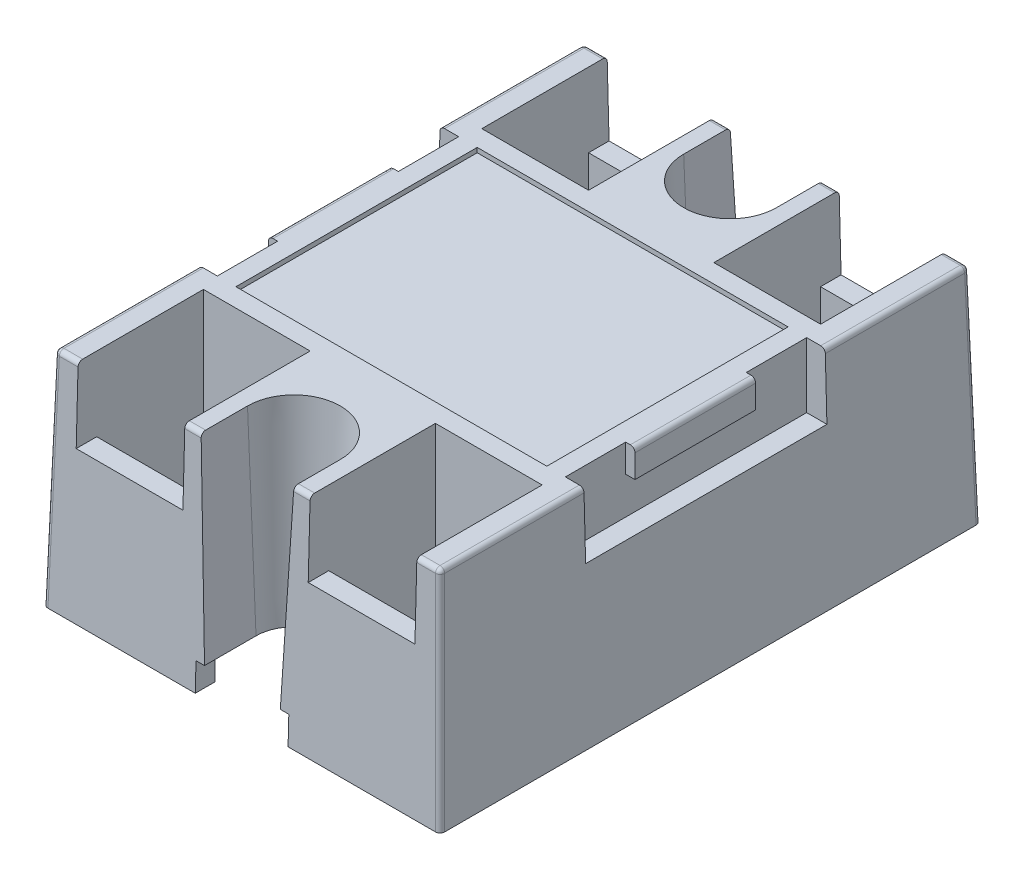
from build123d import *

# Parameters (mm, degrees)
SKETCH1_W            = 41.5
SKETCH1_H            = 57
BOSS_EXTRUDE1_DEPTH  = 24
CUT_EXTRUDE1_DEPTH   = 21
CUT_EXTRUDE1_DRAFT   = -2.5
SKETCH3_W            = 11.5
SKETCH3_H            = 13.5
CUT_EXTRUDE2_DEPTH   = 8
SKETCH4_W            = 11.5
SKETCH4_H            = 11.5
CUT_EXTRUDE3_DEPTH   = 39.714499868
MIRROR1_COPY_1_DEPTH = 21
MIRROR1_COPY_1_DRAFT = -2.5
SKETCH5_W            = 26
SKETCH5_H            = 7
CUT_EXTRUDE4_DEPTH   = 2
SKETCH6_W            = 13
SKETCH6_H            = 3
BOSS_EXTRUDE2_DEPTH  = 1
SKETCH7_W            = 33.5
SKETCH7_H            = 26
CUT_EXTRUDE5_DEPTH   = 0.5
SKETCH8_W            = 38.5
SKETCH8_H            = 54
CUT_EXTRUDE6_DEPTH   = 3
SKETCH9_W            = 10
SKETCH9_H            = 3
CUT_EXTRUDE7_DEPTH   = 66.234672529
DRAFT1_ANGLE         = 1.5
FILLET1_R            = 0.5
SKETCH10_R           = 1.25
BOSS_EXTRUDE3_DEPTH  = 2.5
CHAMFER1_SIZE        = 0.25


with BuildPart() as part:
    # Sketch1 → Boss-Extrude1 (new body)
    with BuildSketch(Plane(origin=(0, 0, 0), x_dir=(1, 0, 0), z_dir=(0, 1, 0))):
        Rectangle(SKETCH1_W, SKETCH1_H)
    extrude(amount=BOSS_EXTRUDE1_DEPTH)


with BuildPart() as cut_extrude1_tool:
    # Sketch2 → Cut-Extrude1 (with draft: the straight prism first)
    with BuildSketch(Plane(origin=(0, 24, 0), x_dir=(1, 0, 0), z_dir=(0, 1, 0))):
        with BuildLine():
            Line((-5, -23.5), (-5, -30.5))
            Line((-5, -30.5), (5, -30.5))
            Line((5, -30.5), (5, -23.5))
            ThreePointArc((5, -23.5), (0, -18.5), (-5, -23.5))
        make_face()
    extrude(amount=-CUT_EXTRUDE1_DEPTH)
    # Cut-Extrude1: the draft: its side faces are tilted about the plane it starts from
    cut_extrude1_sides = [cut_extrude1_tool.faces().sort_by_distance(p)[0] for p in [
        (-5, 13.5, 27),
        (0, 13.5, 30.5),
        (5, 13.5, 27),
        (0, 13.5, 18.5),
    ]]
    draft(cut_extrude1_sides, Plane(origin=(0, 24, 0), x_dir=(1, 0, 0), z_dir=(0, 1, 0)), CUT_EXTRUDE1_DRAFT)


with BuildPart() as part_1:
    add(part.part)

    # Cut-Extrude1: cut by cut_extrude1_tool
    add(cut_extrude1_tool.part, mode=Mode.SUBTRACT)

    # Sketch3 → Cut-Extrude2 (cut)
    with BuildSketch(Plane(origin=(0, 24, 0), x_dir=(1, 0, 0), z_dir=(0, 1, 0))):
        with Locations((-12.5, -21.75)):
            Rectangle(SKETCH3_W, SKETCH3_H)
        with Locations((12.5, -21.75)):
            Rectangle(SKETCH3_W, SKETCH3_H)
    cut_extrude2 = extrude(amount=-CUT_EXTRUDE2_DEPTH, mode=Mode.SUBTRACT)

    # Sketch4 → Cut-Extrude3 (cut, through all)
    with BuildSketch(Plane(origin=(0, 16, 0), x_dir=(1, 0, 0), z_dir=(0, 1, 0))):
        with Locations((-12.5, -20.75)):
            Rectangle(SKETCH4_W, SKETCH4_H)
        with Locations((12.5, -20.75)):
            Rectangle(SKETCH4_W, SKETCH4_H)
    cut_extrude3 = extrude(amount=-CUT_EXTRUDE3_DEPTH, mode=Mode.SUBTRACT)

    # Mirror1: Cut-Extrude2, Cut-Extrude3 across plane
    add(cut_extrude2.mirror(Plane.XY), mode=Mode.SUBTRACT)
    add(cut_extrude3.mirror(Plane.XY), mode=Mode.SUBTRACT)


with BuildPart() as mirror1_copy_1_tool:
    # Mirror1 copy 1 sketch → Mirror1 copy 1 (with draft: the straight prism first)
    with BuildSketch(Plane(origin=(0, 24, 0), x_dir=(1, 0, 0), z_dir=(0, 1, 0))):
        with BuildLine():
            Line((-5, 23.5), (-5, 30.5))
            Line((-5, 30.5), (5, 30.5))
            Line((5, 30.5), (5, 23.5))
            ThreePointArc((5, 23.5), (0, 18.5), (-5, 23.5))
        make_face()
    extrude(amount=-MIRROR1_COPY_1_DEPTH)
    # Mirror1 copy 1: the draft: its side faces are tilted about the plane it starts from
    mirror1_copy_1_sides = [mirror1_copy_1_tool.faces().sort_by_distance(p)[0] for p in [
        (-5, 13.5, -27),
        (0, 13.5, -30.5),
        (5, 13.5, -27),
        (0, 13.5, -18.5),
    ]]
    draft(mirror1_copy_1_sides, Plane(origin=(0, 24, 0), x_dir=(1, 0, 0), z_dir=(0, 1, 0)), MIRROR1_COPY_1_DRAFT)


with BuildPart() as part_2:
    add(part_1.part)

    # Mirror1 copy 1: cut by mirror1_copy_1_tool
    add(mirror1_copy_1_tool.part, mode=Mode.SUBTRACT)

    # Sketch5 → Cut-Extrude4 (cut)
    with BuildSketch(Plane.ZY.offset(20.75)):
        with Locations((0, 20.5)):
            Rectangle(SKETCH5_W, SKETCH5_H)
    cut_extrude4 = extrude(amount=-CUT_EXTRUDE4_DEPTH, mode=Mode.SUBTRACT)

    # Sketch6 → Boss-Extrude2 (add)
    with BuildSketch(Plane.ZY.offset(18.75)):
        with Locations((0, 22.5)):
            Rectangle(SKETCH6_W, SKETCH6_H)
    boss_extrude2 = extrude(amount=BOSS_EXTRUDE2_DEPTH)

    # Mirror2: Cut-Extrude4, Boss-Extrude2 across plane
    add(cut_extrude4.mirror(Plane(origin=(0, 0, 0), x_dir=(0, 0, 1), z_dir=(1, 0, 0))), mode=Mode.SUBTRACT)
    add(boss_extrude2.mirror(Plane(origin=(0, 0, 0), x_dir=(0, 0, 1), z_dir=(1, 0, 0))))

    # Sketch7 → Cut-Extrude5 (cut)
    with BuildSketch(Plane(origin=(0, 24, 0), x_dir=(1, 0, 0), z_dir=(0, 1, 0))):
        Rectangle(SKETCH7_W, SKETCH7_H)
    extrude(amount=-CUT_EXTRUDE5_DEPTH, mode=Mode.SUBTRACT)

    # Sketch8 → Cut-Extrude6 (cut)
    with BuildSketch(Plane.XZ):
        Rectangle(SKETCH8_W, SKETCH8_H)
    extrude(amount=-CUT_EXTRUDE6_DEPTH, mode=Mode.SUBTRACT)

    # Sketch9 → Cut-Extrude7 (cut, through all)
    with BuildSketch(Plane(origin=(0, 0, -28.5), x_dir=(-1, 0, 0), z_dir=(0, 0, -1))):
        with Locations((0, 1.5)):
            Rectangle(SKETCH9_W, SKETCH9_H)
    extrude(amount=-CUT_EXTRUDE7_DEPTH, mode=Mode.SUBTRACT)

    # Draft1
    draft1_faces = [part_2.faces().sort_by_distance(p)[0] for p in [
        (-12.725295126, 9.445247328, -28.5),
        (12.725295126, 9.445247328, -28.5),
        (-20.75, 10.695615514, 0),
        (-12.725295126, 9.445247328, 28.5),
        (12.725295126, 9.445247328, 28.5),
        (20.75, 10.695615514, 0),
    ]]
    draft(draft1_faces, Plane.ZX.offset(24), DRAFT1_ANGLE)

    # Fillet1
    fillet1_edges = [part_2.edges().sort_by_distance(p)[0] for p in [
        (-20.75, 24, -20.75),
        (-19.5, 24, -28.5),
        (5.875, 24, -28.5),
        (-19.5, 24, 28.5),
        (5.875, 24, 28.5),
        (-20.75, 24, 20.75),
        (-19.75, 24, 0),
        (20.75, 24, -20.75),
        (19.75, 24, 0),
        (-5.875, 24, 28.5),
        (20.75, 24, 20.75),
        (19.5, 24, 28.5),
        (19.5, 24, -28.5),
        (21.064231059, 12, 28.814231059),
        (-21.064231059, 12, 28.814231059),
        (-21.064231059, 12, -28.814231059),
        (21.064231059, 12, -28.814231059),
        (-5.875, 24, -28.5),
    ]]
    fillet(fillet1_edges, radius=FILLET1_R)

    # Sketch10 → Boss-Extrude3 (add)
    with BuildSketch(Plane.XZ.offset(-3)):
        with Locations(Location((7, 7.25, 0), (0, 0, 270))):
            Circle(SKETCH10_R)
    extrude(amount=BOSS_EXTRUDE3_DEPTH)

    # Chamfer1
    chamfer1_edges = [part_2.edges().sort_by_distance(p)[0] for p in [
        (7, 0.5, 8.5),
    ]]
    chamfer(chamfer1_edges, length=CHAMFER1_SIZE)


solid = part_2.part
